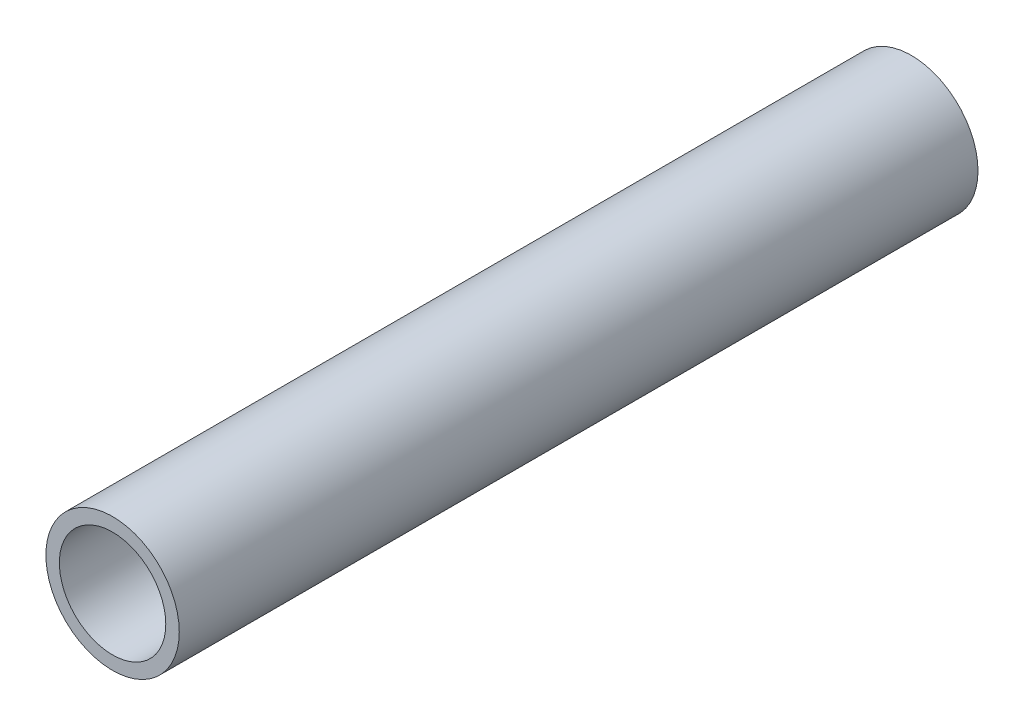
from build123d import *

# Parameters (mm, degrees)
SKETCH1_R           = 16.7005
SKETCH1_R_2         = 13.3223
EXTRUDE_THIN1_DEPTH = 100


with BuildPart() as part:
    # Sketch1 → Extrude-Thin1 (new, symmetric)
    with BuildSketch(Plane.XY):
        Circle(SKETCH1_R)
        Circle(SKETCH1_R_2, mode=Mode.SUBTRACT)
    extrude(amount=EXTRUDE_THIN1_DEPTH, both=True)


solid = part.part
